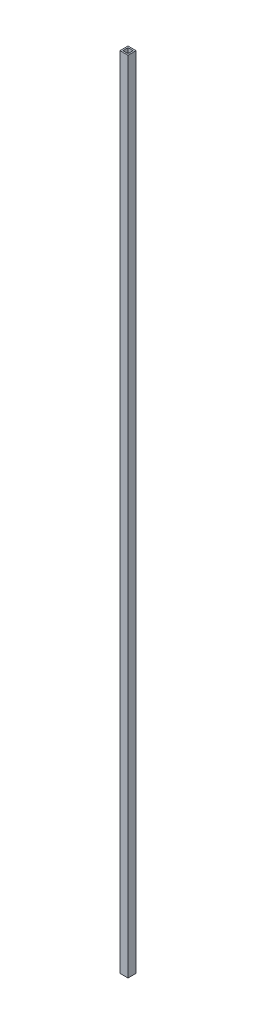
from build123d import *

# Parameters (mm, degrees)
SKETCH_1_W      = 10
SKETCH_1_H      = 10
SKETCH_1_W_2    = 6.4
SKETCH_1_H_2    = 6.4
EXTRUDE_1_DEPTH = 1000


with BuildPart() as part:
    # 草图1 → 凸台-拉伸1 (new body)
    with BuildSketch(Plane(origin=(0, 0, 0), x_dir=(1, 0, 0), z_dir=(0, 1, 0))):
        Rectangle(SKETCH_1_W, SKETCH_1_H)
        Rectangle(SKETCH_1_W_2, SKETCH_1_H_2, mode=Mode.SUBTRACT)
    extrude(amount=EXTRUDE_1_DEPTH)


solid = part.part
